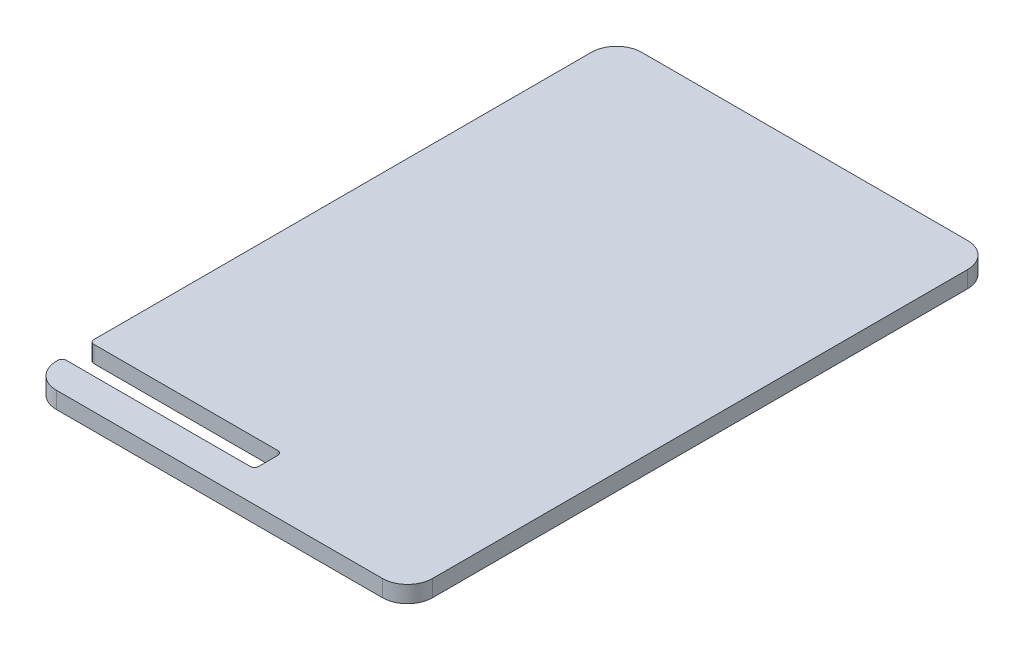
from build123d import *

# Parameters (mm, degrees)
CROQUIS1_W              = 45
CROQUIS1_H              = 70
SALIENTE_EXTRUIR1_DEPTH = 2
CROQUIS2_W              = 23
CROQUIS2_H              = 3.3
CORTAR_EXTRUIR1_DEPTH   = 2
REDONDEO1_R             = 3
REDONDEO2_R             = 0.5


with BuildPart() as part:
    # Croquis1 → Saliente-Extruir1 (new body)
    with BuildSketch(Plane(origin=(0, 0, 0), x_dir=(1, 0, 0), z_dir=(0, 1, 0))):
        with Locations((0, 0.306231574)):
            Rectangle(CROQUIS1_W, CROQUIS1_H)
    extrude(amount=SALIENTE_EXTRUIR1_DEPTH)

    # Croquis2 → Cortar-Extruir1 (cut)
    with BuildSketch(Plane(origin=(0, 2, 0), x_dir=(1, 0, 0), z_dir=(0, 1, 0))):
        with Locations((-11, -29.35)):
            Rectangle(CROQUIS2_W, CROQUIS2_H)
    extrude(amount=-CORTAR_EXTRUIR1_DEPTH, mode=Mode.SUBTRACT)

    # Redondeo1
    redondeo1_edges = [part.edges().sort_by_distance(p)[0] for p in [
        (-22.5, 1, -35.306231574),
        (22.5, 1, -35.306231574),
        (22.5, 1, 34.693768426),
        (-22.5, 1, 34.693768426),
    ]]
    fillet(redondeo1_edges, radius=REDONDEO1_R)

    # Redondeo2
    redondeo2_edges = [part.edges().sort_by_distance(p)[0] for p in [
        (-22.5, 1, 31),
        (-22.5, 1, 27.7),
        (0.5, 1, 27.7),
        (0.5, 1, 31),
    ]]
    fillet(redondeo2_edges, radius=REDONDEO2_R)


solid = part.part
